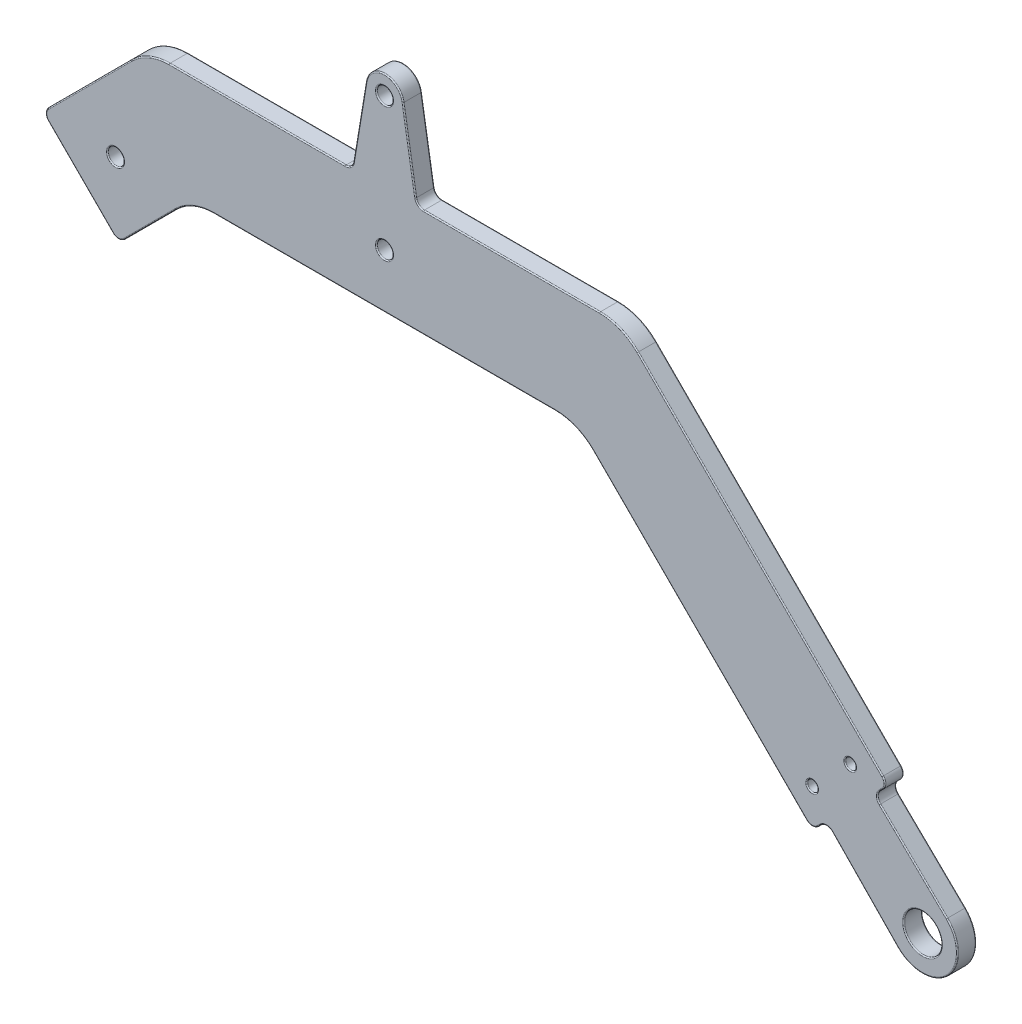
from build123d import *

# Parameters (mm, degrees)
SKETCH6_R           = 3.5
SKETCH6_R_2         = 1.5
SKETCH6_R_3         = 1
BOSS_EXTRUDE1_DEPTH = 3.5
FILLET1_R           = 10
FILLET2_R           = 1.5
FILLET3_R           = 0.2


with BuildPart() as part:
    # Sketch6 → Boss-Extrude1 (new body)
    with BuildSketch(Plane.XY):
        with BuildLine():
            Line((6, 70), (3.453220204, 85.420324662))
            ThreePointArc((3.453220204, 85.420324662), (0, 88.35), (-3.453220204, 85.420324662))
            Line((-3.453220204, 85.420324662), (-6, 70))
            Line((-6, 70), (-44.142135624, 70))
            Line((-44.142135624, 70), (-63.587572106, 50.554563517))
            Line((-63.587572106, 50.554563517), (-49.445436483, 36.412427894))
            Line((-49.445436483, 36.412427894), (-35.857864376, 50))
            Line((-35.857864376, 50), (35.857864376, 50))
            Line((35.857864376, 50), (79.493903346, 6.363961031))
            Line((79.493903346, 6.363961031), (82.149090724, 9.019148409))
            Line((82.149090724, 9.019148409), (95.342398812, -4.533955357))
            ThreePointArc((95.342398812, -4.533955357), (104.596194078, -4.596194078), (104.533955357, 4.657601188))
            Line((104.533955357, 4.657601188), (90.980851591, 17.850909276))
            Line((90.980851591, 17.850909276), (93.636038969, 20.506096654))
            Line((93.636038969, 20.506096654), (44.142135624, 70))
            Line((44.142135624, 70), (6, 70))
        make_face()
        with Locations((100, 0)):
            Circle(SKETCH6_R, mode=Mode.SUBTRACT)
        with Locations((0, 84.85)):
            Circle(SKETCH6_R_2, mode=Mode.SUBTRACT)
        with Locations((0, 60)):
            Circle(SKETCH6_R_2, mode=Mode.SUBTRACT)
        with Locations((86.564971157, 20.506096654)):
            Circle(SKETCH6_R_3, mode=Mode.SUBTRACT)
        with Locations((79.493903346, 13.435028843)):
            Circle(SKETCH6_R_3, mode=Mode.SUBTRACT)
        with Locations((-50, 50)):
            Circle(SKETCH6_R_2, mode=Mode.SUBTRACT)
    extrude(amount=BOSS_EXTRUDE1_DEPTH)

    # Fillet1
    fillet1_edges = [part.edges().sort_by_distance(p)[0] for p in [
        (44.142135624, 70, 1.75),
        (35.857864376, 50, 1.75),
        (-35.857864376, 50, 1.75),
        (-44.142135624, 70, 1.75),
    ]]
    fillet(fillet1_edges, radius=FILLET1_R)

    # Fillet2
    fillet2_edges = [part.edges().sort_by_distance(p)[0] for p in [
        (6, 70, 1.75),
        (93.636038969, 20.506096654, 1.75),
        (90.980851591, 17.850909276, 1.75),
        (82.149090724, 9.019148409, 1.75),
        (79.493903346, 6.363961031, 1.75),
        (-49.445436483, 36.412427894, 1.75),
        (-63.587572106, 50.554563517, 1.75),
        (-6, 70, 1.75),
    ]]
    fillet(fillet2_edges, radius=FILLET2_R)

    # Fillet3
    fillet3_edges = [part.edges().sort_by_distance(p)[0] for p in [
        (-23.636292033, 70, 3.5),
        (80.814314994, 7.684372679, 3.5),
        (89.275978249, 1.697903009, 3.5),
        (98.302096991, 10.724021751, 3.5),
        (92.315627321, 19.185685006, 3.5),
        (69.823223305, 44.318912319, 3.5),
        (4.622926377, 78.337949903, 3.5),
        (-4.622926377, 78.337949903, 3.5),
        (93.014718626, 20.506096654, 3.5),
        (79.493903346, 6.985281374, 3.5),
        (-62.966251763, 50.554563517, 3.5),
        (-49.445436483, 37.033748237, 3.5),
        (-6.302181387, 70.356182427, 0),
        (-6.302181387, 70.356182427, 3.5),
        (6.302181387, 70.356182427, 0),
        (6.302181387, 70.356182427, 3.5),
        (91.616569941, 17.855184959, 0),
        (91.616569941, 17.855184959, 3.5),
        (82.144815041, 8.383430059, 0),
        (82.144815041, 8.383430059, 3.5),
        (96.5, 0, 3.5),
        (-1.5, 84.85, 3.5),
        (-1.5, 60, 3.5),
        (85.564971157, 20.506096654, 3.5),
        (104.596194078, -4.596194078, 0),
        (78.493903346, 13.435028843, 3.5),
        (0, 88.35, 0),
        (-51.5, 50, 0),
        (78.493903346, 13.435028843, 0),
        (85.564971157, 20.506096654, 0),
        (-1.5, 60, 0),
        (-1.5, 84.85, 0),
        (96.5, 0, 0),
        (-51.5, 50, 3.5),
        (0, 88.35, 3.5),
        (58.610019869, 27.247844507, 0),
        (58.610019869, 27.247844507, 3.5),
        (0, 50, 0),
        (0, 50, 3.5),
        (-54.798989873, 59.343145751, 0),
        (-54.798989873, 59.343145751, 3.5),
        (23.636292033, 70, 0),
        (43.826834324, 69.238795325, 0),
        (-43.826834324, 69.238795325, 0),
        (23.636292033, 70, 3.5),
        (43.826834324, 69.238795325, 3.5),
        (-43.826834324, 69.238795325, 3.5),
        (35.542563076, 49.238795325, 0),
        (35.542563076, 49.238795325, 3.5),
        (-35.542563076, 49.238795325, 0),
        (-35.542563076, 49.238795325, 3.5),
        (-43.585786438, 42.272077939, 0),
        (-43.585786438, 42.272077939, 3.5),
        (-23.636292033, 70, 0),
        (-4.622926377, 78.337949903, 0),
        (4.622926377, 78.337949903, 0),
        (69.823223305, 44.318912319, 0),
        (92.315627321, 19.185685006, 0),
        (98.302096991, 10.724021751, 0),
        (89.275978249, 1.697903009, 0),
        (80.814314994, 7.684372679, 0),
        (-56.516504294, 43.483495706, 0),
        (93.014718626, 20.506096654, 0),
        (104.596194078, -4.596194078, 3.5),
        (79.493903346, 6.985281374, 0),
        (-62.966251763, 50.554563517, 0),
        (-49.445436483, 37.033748237, 0),
        (-56.516504294, 43.483495706, 3.5),
    ]]
    fillet(fillet3_edges, radius=FILLET3_R)


solid = part.part
